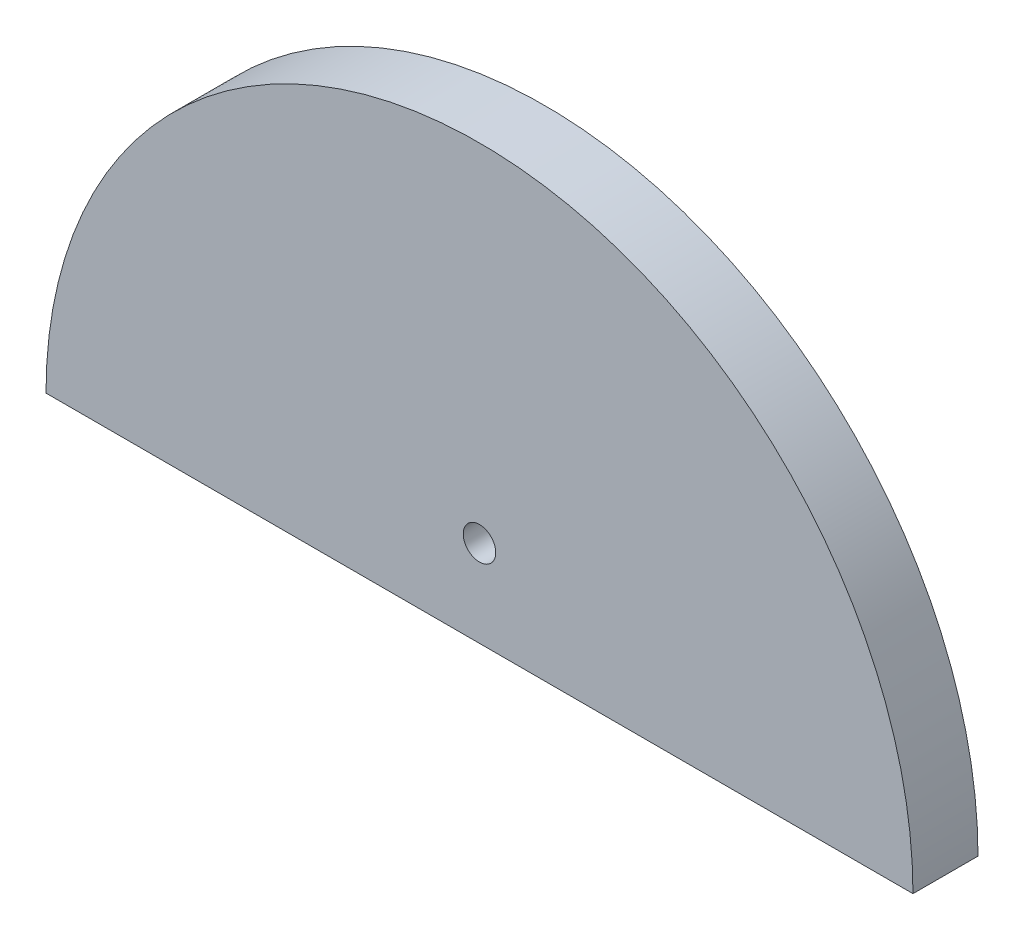
from build123d import *

# Parameters (mm, degrees)
BOSS_EXTRUDE1_DEPTH   = 3
F_1_5MM_DOWEL_HOLE1_D = 1.5


with BuildPart() as part:
    # Sketch1-disc_sketch<2> → Boss-Extrude1 (new body)
    with BuildSketch(Plane.XY):
        with BuildLine():
            ThreePointArc((20, 0), (0, 20), (-20, 0))
            Line((-20, 0), (20, 0))
        make_face()
    extrude(amount=BOSS_EXTRUDE1_DEPTH)

    # Ø1.5mm Dowel Hole1 (through all)
    with Locations(Plane.XY.offset(3)):
        with Locations((0, 4)):
            Hole(F_1_5MM_DOWEL_HOLE1_D / 2)


solid = part.part
